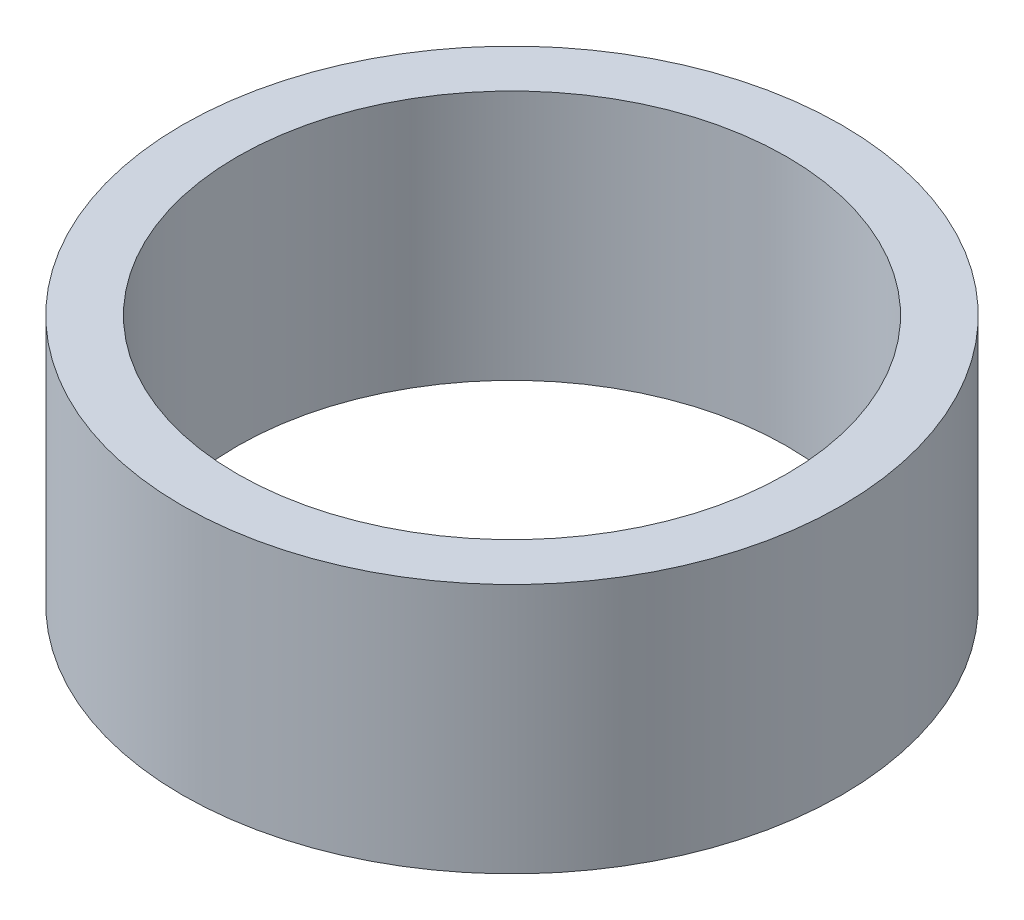
from build123d import *

# Parameters (mm, degrees)
SKETCH2_R           = 3
SKETCH2_R_2         = 2.5
BOSS_EXTRUDE1_DEPTH = 2.28


with BuildPart() as part:
    # Sketch2 → Boss-Extrude1 (new body)
    with BuildSketch(Plane(origin=(0, 0, 0), x_dir=(1, 0, 0), z_dir=(0, 1, 0))):
        with Locations(Location((0, 0, 0), (0, 0, 270))):
            Circle(SKETCH2_R)
        with Locations(Location((0, 0, 0), (0, 0, 270))):
            Circle(SKETCH2_R_2, mode=Mode.SUBTRACT)
    extrude(amount=BOSS_EXTRUDE1_DEPTH)


solid = part.part
